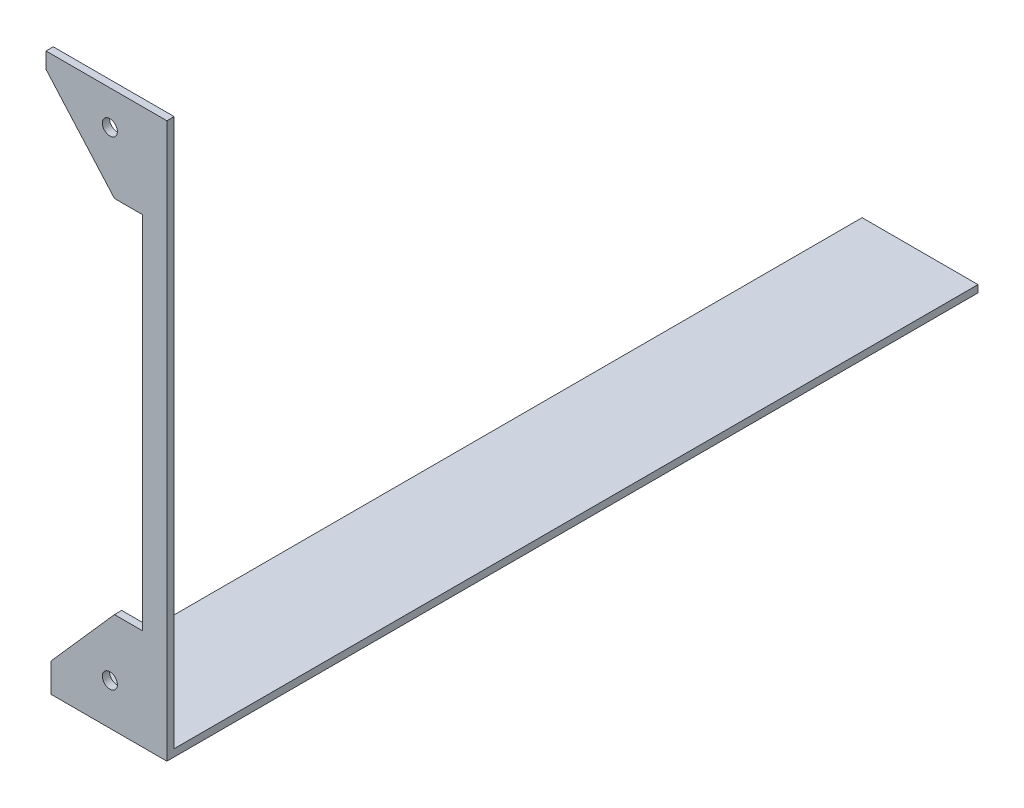
from build123d import *

# Parameters (mm, degrees)
BOSS_EXTRUDE1_DEPTH = 1.5875
SKETCH2_W           = 25.4
SKETCH2_H           = 177.8
BOSS_EXTRUDE2_DEPTH = 1.5875


with BuildPart() as part:
    # Sketch1 → Boss-Extrude1 (new body)
    with BuildSketch(Plane.XY):
        Polygon((0, 120), (-26.5, 120), (-26.5, 116.5), (-11.5, 99.5), (-5.4, 99.5), (-5.4, 20.5), (-11.5, 20.5), (-25.4, 4.746666667), (-25.4, 0), (0, 0), align=None)
        with BuildLine():
            ThreePointArc((-10.85, 7.5), (-12.5, 5.85), (-14.15, 7.5))
            ThreePointArc((-14.15, 7.5), (-12.5, 9.15), (-10.85, 7.5))
        make_face(mode=Mode.SUBTRACT)
        with BuildLine():
            ThreePointArc((-10.85, 112.5), (-12.5, 110.85), (-14.15, 112.5))
            ThreePointArc((-14.15, 112.5), (-12.5, 114.15), (-10.85, 112.5))
        make_face(mode=Mode.SUBTRACT)
    extrude(amount=BOSS_EXTRUDE1_DEPTH)

    # Sketch2 → Boss-Extrude2 (add)
    with BuildSketch(Plane(origin=(0, 0, 0), x_dir=(1, 0, 0), z_dir=(0, 1, 0))):
        with Locations((-12.7, 87.3125)):
            Rectangle(SKETCH2_W, SKETCH2_H)
    extrude(amount=-BOSS_EXTRUDE2_DEPTH)


solid = part.part
